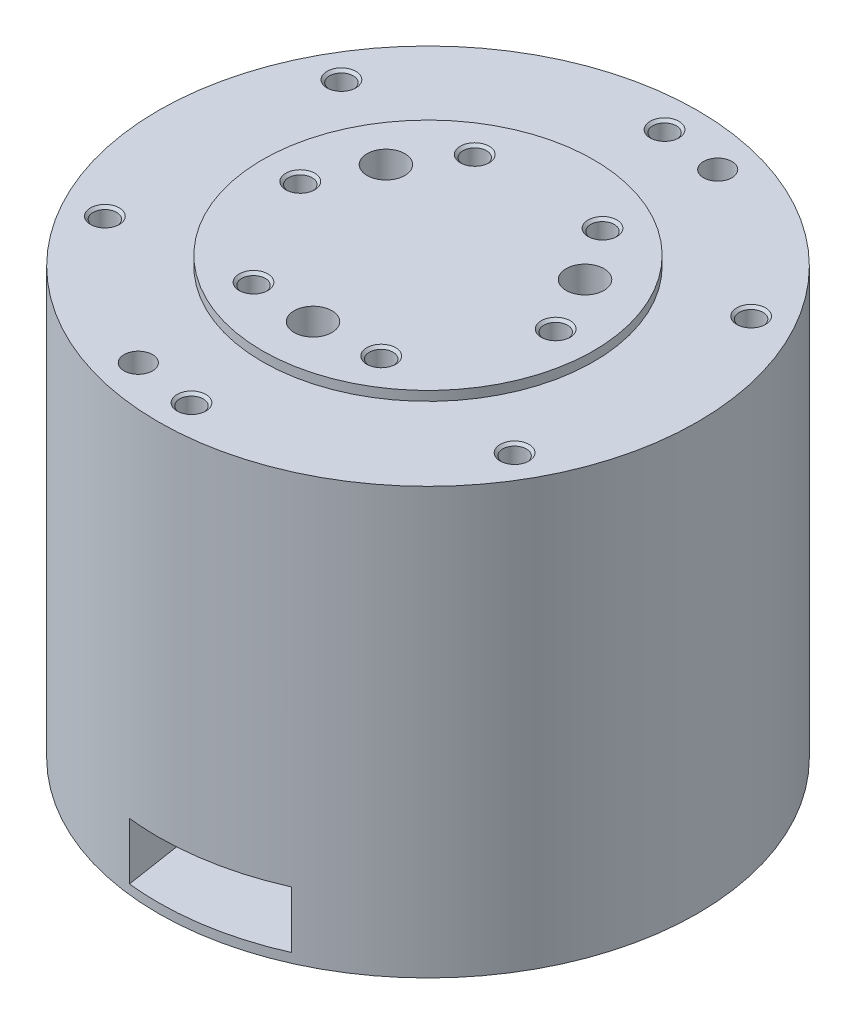
from build123d import *

# Parameters (mm, degrees)
SKETCH_1_R               = 28.5
EXTRUDE_1_DEPTH          = 45
EXTRUDE_2_DEPTH          = 1
EXTRUDE_2_DEPTH_BACK     = 30
SKETCH_2_R               = 17.5
PATTERN_CIRCULAR_2_COUNT = 6
SKETCH_11_2_R            = 1.5
CUT_EXTRUDE_1_DEPTH      = 5
PATTERN_CIRCULAR_3_COUNT = 6
SKETCH_13_2_R            = 2
CUT_EXTRUDE_2_DEPTH      = 4
PATTERN_CIRCULAR_4_COUNT = 4
CUT_EXTRUDE_START        = -1
SKETCH_18_W              = 15
SKETCH_18_H              = 10
CUT_EXTRUDE_3_DEPTH      = 6


with BuildPart() as part:
    # 草图1 → 凸台-拉伸1 (new body)
    with BuildSketch(Plane(origin=(0, 0, 0), x_dir=(1, 0, 0), z_dir=(0, 1, 0))):
        Circle(SKETCH_1_R)
    extrude(amount=EXTRUDE_1_DEPTH)

    # 草图2 → 凸台-拉伸2 (add, two sides: drawn at the far end of the back side and taken through both)
    with BuildSketch(Plane(origin=(0, 45, 0), x_dir=(1, 0, 0), z_dir=(0, 1, 0)).offset(-EXTRUDE_2_DEPTH_BACK)):
        Circle(SKETCH_2_R)
    extrude(amount=EXTRUDE_2_DEPTH + EXTRUDE_2_DEPTH_BACK)

    # 草图12 → M3 螺纹孔2 (revolve, cut)
    with BuildSketch(Plane(origin=(0, 45, -25), x_dir=(0, 0, 1), z_dir=(1, 0, 0))):
        Polygon((0, 0), (0, 5.751075774), (1.25, 5), (1.25, 0.275), (1.525, 0), align=None)
    hole_wizard_m3_2 = revolve(axis=Axis((0, 51.35, -25), (0, -1, 0)), mode=Mode.SUBTRACT)

    # 阵列(圆周)2: M3 螺纹孔2 ×6 about axis
    pattern_circular_2_axis = Axis((0, 0, 0), (0, -1, 0))
    for i in range(1, PATTERN_CIRCULAR_2_COUNT):
        add(hole_wizard_m3_2.rotate(pattern_circular_2_axis, i * 360 / PATTERN_CIRCULAR_2_COUNT), mode=Mode.SUBTRACT)

    # 草图11<2> → 切除-拉伸1 (cut)
    with BuildSketch(Plane(origin=(0, 45, 0), x_dir=(1, 0, 0), z_dir=(0, 1, 0))):
        with Locations((6.470476128, 24.148145657)):
            Circle(SKETCH_11_2_R)
        with Locations((-6.470476128, -24.148145657)):
            Circle(SKETCH_11_2_R)
    extrude(amount=-CUT_EXTRUDE_1_DEPTH, mode=Mode.SUBTRACT)

    # 草图14 → M3 螺纹孔3 (revolve, cut)
    with BuildSketch(Plane(origin=(-13.5, 46, 0), x_dir=(0, 0, 1), z_dir=(1, 0, 0))):
        Polygon((0, 0), (0, 5.751075774), (1.25, 5), (1.25, 0.275), (1.525, 0), align=None)
    hole_wizard_m3_3 = revolve(axis=Axis((-13.5, 52.35, 0), (0, -1, 0)), mode=Mode.SUBTRACT)

    # 阵列(圆周)3: M3 螺纹孔3 ×6 about axis
    pattern_circular_3_axis = Axis((0, 45, 0), (0, -1, 0))
    for i in range(1, PATTERN_CIRCULAR_3_COUNT):
        add(hole_wizard_m3_3.rotate(pattern_circular_3_axis, i * 360 / PATTERN_CIRCULAR_3_COUNT), mode=Mode.SUBTRACT)

    # 草图13<2> → 切除-拉伸2 (cut)
    with BuildSketch(Plane(origin=(0, 46, 0), x_dir=(1, 0, 0), z_dir=(0, 1, 0))):
        with Locations((0, -12.15)):
            Circle(SKETCH_13_2_R)
        with Locations((-10.522208656, 6.075)):
            Circle(SKETCH_13_2_R)
        with Locations((10.522208656, 6.075)):
            Circle(SKETCH_13_2_R)
    extrude(amount=-CUT_EXTRUDE_2_DEPTH, mode=Mode.SUBTRACT)

    # 草图17 → M3 螺纹孔4 (revolve, cut)
    with BuildSketch(Plane(origin=(13.435028843, 0, 13.435028843), x_dir=(0, 0, -1), z_dir=(1, 0, 0))):
        Polygon((0, 0), (0, 4.751075774), (1.25, 4), (1.25, 0.275), (1.525, 0), align=None)
    hole_wizard_m3_4 = revolve(axis=Axis((13.435028843, -6.35, 13.435028843), (0, 1, 0)), mode=Mode.SUBTRACT)

    # 阵列(圆周)4: M3 螺纹孔4 ×4 about axis
    pattern_circular_4_axis = Axis((0, 45, 0), (0, -1, 0))
    for i in range(1, PATTERN_CIRCULAR_4_COUNT):
        add(hole_wizard_m3_4.rotate(pattern_circular_4_axis, i * 360 / PATTERN_CIRCULAR_4_COUNT), mode=Mode.SUBTRACT)

    # 草图18 → 切除-拉伸3 (cut)
    with BuildSketch(Plane.XZ.offset(CUT_EXTRUDE_START)):
        with Locations((0, -23.5)):
            Rectangle(SKETCH_18_W, SKETCH_18_H)
        Polygon((11.748383566, 27.027309958), (10.227092755, 17.143703619), (-4.598316754, 19.425639836), (-3.077025943, 29.309246175), align=None)
    extrude(amount=-CUT_EXTRUDE_3_DEPTH, mode=Mode.SUBTRACT)


solid = part.part
